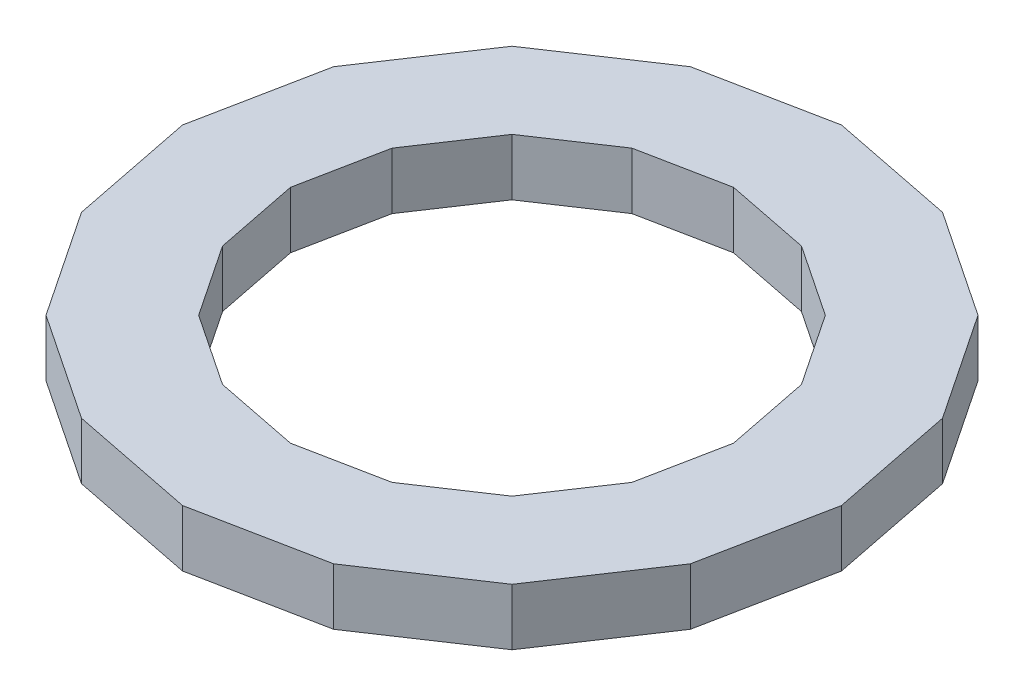
from build123d import *

# Parameters (mm, degrees)
BOSS_EXTRUDE1_DEPTH = 19.05


with BuildPart() as part:
    # Sketch1 → Boss-Extrude1 (new body)
    with BuildSketch(Plane(origin=(0, 0, 0), x_dir=(1, 0, 0), z_dir=(0, 1, 0))):
        Polygon((110.666689033, 0), (102.242688929, 42.350308408), (78.253166267, 78.253166267), (42.350308408, 102.242688929), (0, 110.666689033), (-42.350308408, 102.242688929), (-78.253166267, 78.253166267), (-102.242688929, 42.350308408), (-110.666689033, 0), (-102.242688929, -42.350308408), (-78.253166267, -78.253166267), (-42.350308408, -102.242688929), (0, -110.666689033), (42.350308408, -102.242688929), (78.253166267, -78.253166267), (102.242688929, -42.350308408), align=None)
        Polygon((74.410027448, 0), (68.745901372, 28.475484706), (52.615834996, 52.615834996), (28.475484706, 68.745901372), (0, 74.410027448), (-28.475484706, 68.745901372), (-52.615834996, 52.615834996), (-68.745901372, 28.475484706), (-74.410027448, 0), (-68.745901372, -28.475484706), (-52.615834996, -52.615834996), (-28.475484706, -68.745901372), (0, -74.410027448), (28.475484706, -68.745901372), (52.615834996, -52.615834996), (68.745901372, -28.475484706), align=None, mode=Mode.SUBTRACT)
    extrude(amount=BOSS_EXTRUDE1_DEPTH)


solid = part.part
